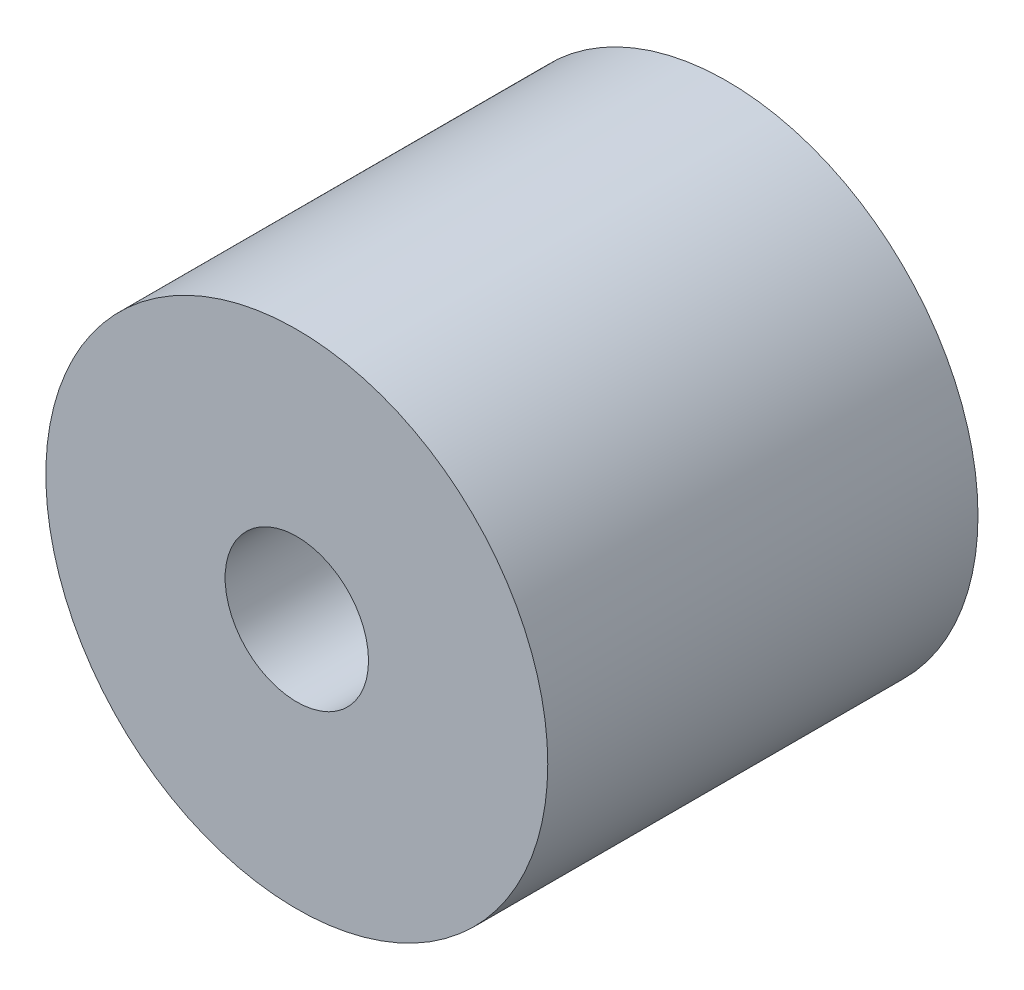
from build123d import *

# Parameters (mm, degrees)
SKETCH1_R           = 17.5
SKETCH1_R_2         = 5
BOSS_EXTRUDE1_DEPTH = 30


with BuildPart() as part:
    # Sketch1 → Boss-Extrude1 (new body)
    with BuildSketch(Plane.XY):
        Circle(SKETCH1_R)
        Circle(SKETCH1_R_2, mode=Mode.SUBTRACT)
    extrude(amount=BOSS_EXTRUDE1_DEPTH)


solid = part.part
